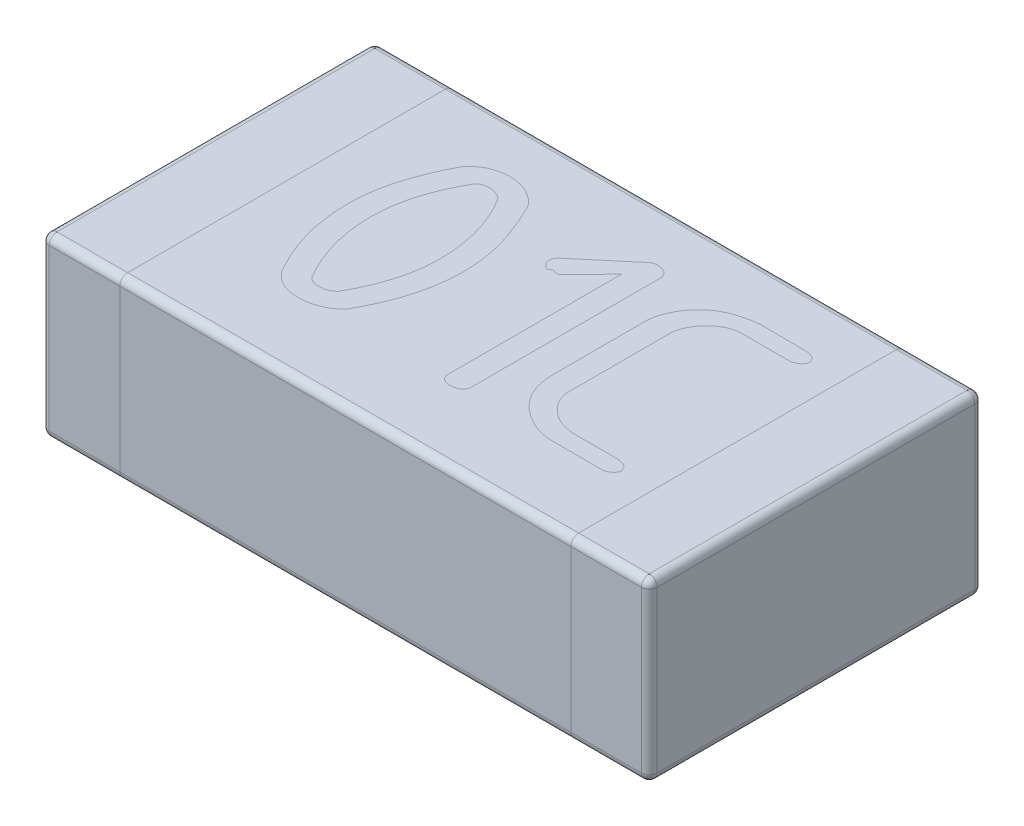
from build123d import *

# Parameters (mm, degrees)
BOSS_EXTRUDE1_DEPTH = 0.225
FILLET2_R           = 0.02


with BuildPart() as part:
    # Sketch1 → Boss-Extrude1 (new, symmetric)
    with BuildSketch(Plane(origin=(0, 0, 0), x_dir=(1, 0, 0), z_dir=(0, 1, 0))):
        with BuildLine():
            Line((-0.755, -0.425), (0.755, -0.425))
            ThreePointArc((0.755, -0.425), (0.769142136, -0.419142136), (0.775, -0.405))
            Line((0.775, -0.405), (0.775, 0.405))
            ThreePointArc((0.775, 0.405), (0.769142136, 0.419142136), (0.755, 0.425))
            Line((0.755, 0.425), (-0.755, 0.425))
            ThreePointArc((-0.755, 0.425), (-0.769142136, 0.419142136), (-0.775, 0.405))
            Line((-0.775, 0.405), (-0.775, -0.405))
            ThreePointArc((-0.775, -0.405), (-0.769142136, -0.419142136), (-0.755, -0.425))
        make_face()
    extrude(amount=BOSS_EXTRUDE1_DEPTH, both=True)

    # Fillet2
    fillet2_edges = [part.edges().sort_by_distance(p)[0] for p in [
        (0.769142136, 0.225, 0.419142136),
        (0, -0.225, -0.425),
        (0, -0.225, 0.425),
        (-0.769142136, -0.225, 0.419142136),
        (0.775, 0.225, 0),
        (0.769142136, 0.225, -0.419142136),
        (0, 0.225, -0.425),
        (-0.769142136, 0.225, -0.419142136),
        (-0.775, 0.225, 0),
        (-0.769142136, 0.225, 0.419142136),
        (0, 0.225, 0.425),
        (0, 0.225, 0.425),
        (0, 0.225, -0.425),
        (0, 0.225, -0.425),
        (0, 0.225, 0.425),
        (-0.775, -0.225, 0),
        (-0.769142136, -0.225, -0.419142136),
        (0, -0.225, -0.425),
        (0.769142136, -0.225, -0.419142136),
        (0, -0.225, 0.425),
        (0.775, -0.225, 0),
        (0, -0.225, 0.425),
        (0.769142136, -0.225, 0.419142136),
        (0, -0.225, -0.425),
    ]]
    fillet(fillet2_edges, radius=FILLET2_R)


solid = part.part
